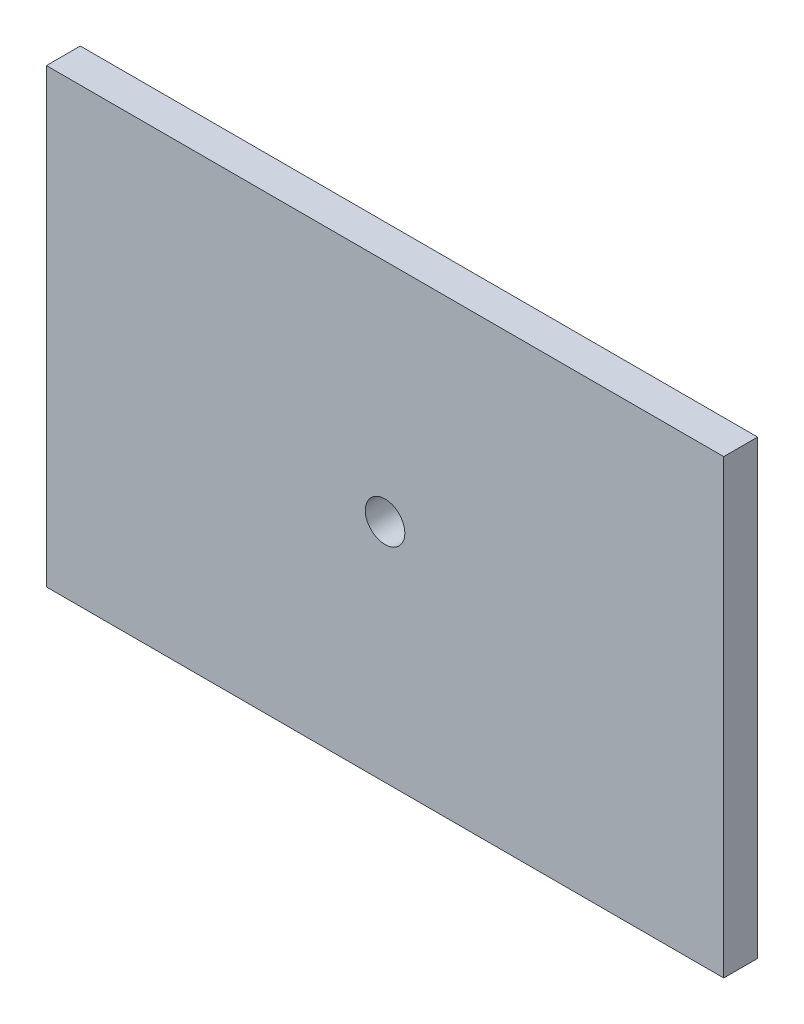
from build123d import *

# Parameters (mm, degrees)
SKETCH1_W               = 120
SKETCH1_H               = 80
BOSS_EXTRUDE1_DEPTH     = 6
CUT_EXTRUDE3_DEPTH      = 73.360210061
CUT_EXTRUDE3_DEPTH_BACK = 73.360210061
SKETCH2_R               = 3.5


with BuildPart() as part:
    # Sketch1 → Boss-Extrude1 (new body)
    with BuildSketch(Plane.XY):
        Rectangle(SKETCH1_W, SKETCH1_H)
    extrude(amount=BOSS_EXTRUDE1_DEPTH)

    # Sketch2 → Cut-Extrude3 (cut, two sides: drawn at the far end of the back side and taken through both)
    with BuildSketch(Plane.XY.offset(-CUT_EXTRUDE3_DEPTH_BACK)):
        Circle(SKETCH2_R)
    extrude(amount=CUT_EXTRUDE3_DEPTH + CUT_EXTRUDE3_DEPTH_BACK, mode=Mode.SUBTRACT)


solid = part.part
